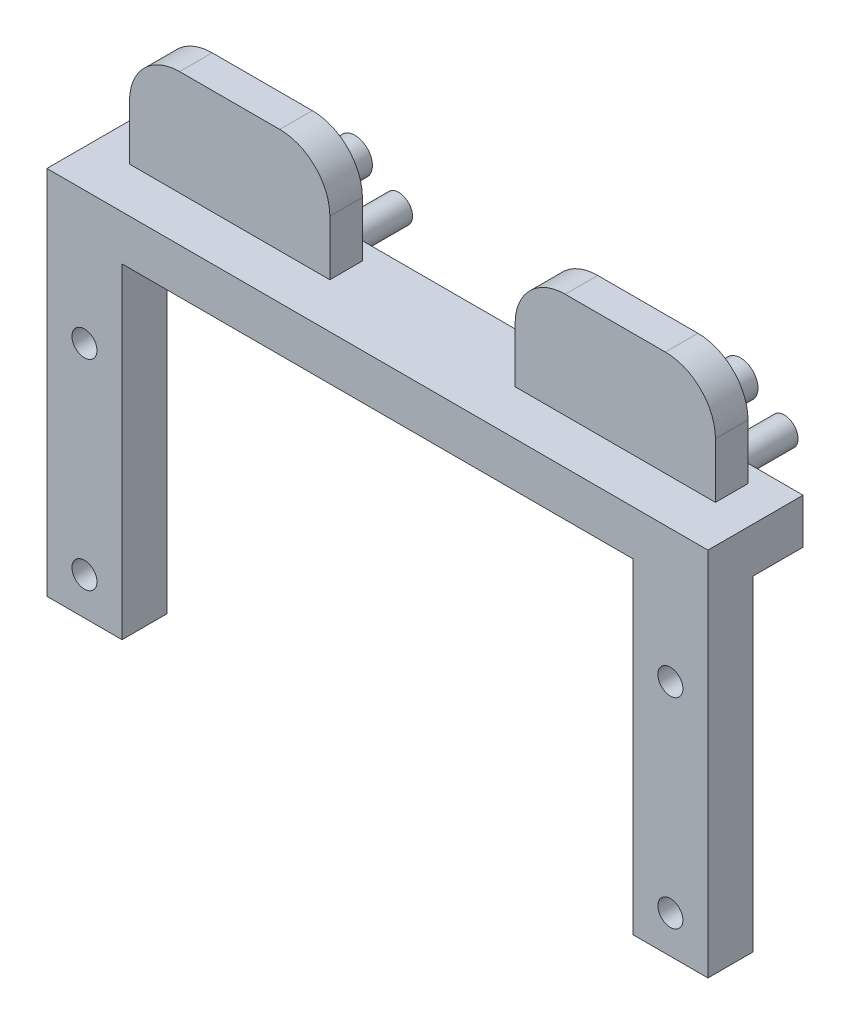
from build123d import *

# Parameters (mm, degrees)
BOSS_EXTRUDE2_START  = -1
SKETCH1_W            = 66
SKETCH1_H            = 19
BOSS_EXTRUDE2_DEPTH  = 9
SKETCH3_R            = 2.75
BOSS_EXTRUDE3_DEPTH  = 13.75
SKETCH4_W            = 4.5
SKETCH4_H            = 6.5
BOSS_EXTRUDE4_DEPTH  = 15
BOSS_EXTRUDE5_DEPTH  = 8.5
SKETCH8_W            = 9
SKETCH8_H            = 6.5
BOSS_EXTRUDE6_DEPTH  = 6
SKETCH9_W            = 15.5
SKETCH9_H            = 6.5
BOSS_EXTRUDE7_DEPTH  = 21
BOSS_EXTRUDE8_DEPTH  = 8.5
CUT_EXTRUDE2_START   = -8.5
SKETCH12_R           = 3.5
CUT_EXTRUDE2_DEPTH   = 8.5
FILLET1_R            = 10
SKETCH14_W           = 15
SKETCH14_H           = 9
BOSS_EXTRUDE10_DEPTH = 65
CUT_EXTRUDE3_REACH   = 98.312
SKETCH15_R           = 2.5
FILLET1_OF_MIRROR3_R = 10


with BuildPart() as part:
    # Sketch1 → Boss-Extrude2 (new body)
    with BuildSketch(Plane(origin=(0, 0, 0), x_dir=(1, 0, 0), z_dir=(0, 1, 0)).offset(BOSS_EXTRUDE2_START)):
        with Locations((33, 18)):
            Rectangle(SKETCH1_W, SKETCH1_H)
    boss_extrude2 = extrude(amount=BOSS_EXTRUDE2_DEPTH)

    # Sketch3 → Boss-Extrude3 (add)
    with BuildSketch(Plane(origin=(0, 0, -27.5), x_dir=(-1, 0, 0), z_dir=(0, 0, -1))):
        with Locations((-37.5, 3.5)):
            Circle(SKETCH3_R)
        with Locations((-17.5, 3.5)):
            Circle(SKETCH3_R)
    boss_extrude3 = extrude(amount=BOSS_EXTRUDE3_DEPTH)

    # Sketch4 → Boss-Extrude4 (add)
    with BuildSketch(Plane(origin=(0, 8, 0), x_dir=(1, 0, 0), z_dir=(0, 1, 0))):
        with Locations((25.25, 20.75)):
            Rectangle(SKETCH4_W, SKETCH4_H)
        with Locations((29.75, 20.75)):
            Rectangle(SKETCH4_W, SKETCH4_H)
    boss_extrude4 = extrude(amount=BOSS_EXTRUDE4_DEPTH)

    # Sketch5 → Boss-Extrude5 (add)
    with BuildSketch(Plane(origin=(0, 0, -24), x_dir=(-1, 0, 0), z_dir=(0, 0, -1))):
        with BuildLine():
            ThreePointArc((-25.636419782, 13.037388184), (-24.436298745, 14.307742745), (-24, 16))
            ThreePointArc((-24, 16), (-29.974873734, 18.474873734), (-27.5, 12.5))
            ThreePointArc((-27.5, 12.5), (-26.685966178, 12.595980474), (-25.916578842, 12.878657751))
            ThreePointArc((-25.916578842, 12.878657751), (-25.85405917, 13.094916041), (-25.636419782, 13.037388184))
        make_face()
    extrude(amount=BOSS_EXTRUDE5_DEPTH)

    # Sketch8 → Boss-Extrude6 (add)
    with BuildSketch(Plane(origin=(0, 23, 0), x_dir=(1, 0, 0), z_dir=(0, 1, 0))):
        with Locations((27.5, 20.75)):
            Rectangle(SKETCH8_W, SKETCH8_H)
    boss_extrude6 = extrude(amount=BOSS_EXTRUDE6_DEPTH)

    # Sketch9 → Boss-Extrude7 (add)
    with BuildSketch(Plane(origin=(0, 8, 0), x_dir=(1, 0, 0), z_dir=(0, 1, 0))):
        with Locations((39.75, 20.75)):
            Rectangle(SKETCH9_W, SKETCH9_H)
        with Locations((15.25, 20.75)):
            Rectangle(SKETCH9_W, SKETCH9_H)
    boss_extrude7 = extrude(amount=BOSS_EXTRUDE7_DEPTH)

    # Sketch10 → Boss-Extrude8 (add)
    with BuildSketch(Plane(origin=(0, 0, -24), x_dir=(-1, 0, 0), z_dir=(0, 0, -1))):
        with BuildLine():
            Line((-21, 17), (-17.5, 17))
            Line((-17.5, 17), (-14, 17))
            ThreePointArc((-14, 17), (-17.5, 20.5), (-21, 17))
        make_face()
        with BuildLine():
            Line((-17.5, 13.5), (-17.5, 17))
            Line((-17.5, 17), (-21, 17))
            ThreePointArc((-21, 17), (-19.974873734, 14.525126266), (-17.5, 13.5))
        make_face()
        with BuildLine():
            Line((-14, 17), (-17.5, 17))
            Line((-17.5, 17), (-17.5, 13.5))
            ThreePointArc((-17.5, 13.5), (-15.025126266, 14.525126266), (-14, 17))
        make_face()
        with BuildLine():
            Line((-37.5, 17), (-34, 17))
            ThreePointArc((-34, 17), (-37.5, 20.5), (-41, 17))
            Line((-41, 17), (-37.5, 17))
        make_face()
        with BuildLine():
            ThreePointArc((-37.5, 13.5), (-35.025126266, 14.525126266), (-34, 17))
            Line((-34, 17), (-37.5, 17))
            Line((-37.5, 17), (-37.5, 13.5))
        make_face()
        with BuildLine():
            Line((-37.5, 13.5), (-37.5, 17))
            Line((-37.5, 17), (-41, 17))
            ThreePointArc((-41, 17), (-39.974873734, 14.525126266), (-37.5, 13.5))
        make_face()
    boss_extrude8 = extrude(amount=BOSS_EXTRUDE8_DEPTH)

    # Sketch12 → Cut-Extrude2 (cut)
    with BuildSketch(Plane(origin=(0, 0, -32.5), x_dir=(-1, 0, 0), z_dir=(0, 0, -1)).offset(CUT_EXTRUDE2_START)):
        with Locations((-27.5, 16)):
            Circle(SKETCH12_R)
    extrude(amount=CUT_EXTRUDE2_DEPTH, mode=Mode.SUBTRACT)

    # Fillet1
    fillet1_edges = [part.edges().sort_by_distance(p)[0] for p in [
        (7.5, 29, -20.75),
        (47.5, 29, -20.75),
    ]]
    fillet(fillet1_edges, radius=FILLET1_R)

    # Sketch14 → Boss-Extrude10 (add)
    with BuildSketch(Plane.XZ.offset(1)):
        with Locations((7.5, -13)):
            Rectangle(SKETCH14_W, SKETCH14_H)
    boss_extrude10 = extrude(amount=BOSS_EXTRUDE10_DEPTH)

    # Sketch15 → Cut-Extrude3 (cut, up to next)
    with BuildSketch(Plane(origin=(0, 0, -17.5), x_dir=(-1, 0, 0), z_dir=(0, 0, -1)), mode=Mode.PRIVATE) as cut_extrude3_sk1:
        with Locations((-7.5, -18.5)):
            Circle(SKETCH15_R)
    cut_extrude3_tool1 = extrude(cut_extrude3_sk1.sketch, amount=-CUT_EXTRUDE3_REACH, mode=Mode.PRIVATE) & part.part
    # Sketch15 → Cut-Extrude3 (cut, up to next)
    with BuildSketch(Plane(origin=(0, 0, -17.5), x_dir=(-1, 0, 0), z_dir=(0, 0, -1)), mode=Mode.PRIVATE) as cut_extrude3_sk2:
        with Locations((-7.5, -58.5)):
            Circle(SKETCH15_R)
    cut_extrude3_tool2 = extrude(cut_extrude3_sk2.sketch, amount=-CUT_EXTRUDE3_REACH, mode=Mode.PRIVATE) & part.part
    cut_extrude3_1 = cut_extrude3_tool1.solids().sort_by_distance((7.5, -18.5, -17.5))[0]
    add(cut_extrude3_1, mode=Mode.SUBTRACT)
    cut_extrude3_2 = cut_extrude3_tool2.solids().sort_by_distance((7.5, -58.5, -17.5))[0]
    add(cut_extrude3_2, mode=Mode.SUBTRACT)
    cut_extrude3 = cut_extrude3_1 + cut_extrude3_2  # Cut-Extrude3 as one shape, for the pattern or mirror that repeats it

    # Mirror3: Boss-Extrude2, Boss-Extrude3, Boss-Extrude4, Boss-Extrude6, Boss-Extrude7, Boss-Extrude8, Boss-Extrude10, Cut-Extrude3 across plane
    add(boss_extrude2.mirror(Plane(origin=(66, -1, -8.5), x_dir=(0, 0, 1), z_dir=(1, 0, 0))))
    add(boss_extrude3.mirror(Plane(origin=(66, -1, -8.5), x_dir=(0, 0, 1), z_dir=(1, 0, 0))))
    add(boss_extrude4.mirror(Plane(origin=(66, -1, -8.5), x_dir=(0, 0, 1), z_dir=(1, 0, 0))))
    add(boss_extrude6.mirror(Plane(origin=(66, -1, -8.5), x_dir=(0, 0, 1), z_dir=(1, 0, 0))))
    add(boss_extrude7.mirror(Plane(origin=(66, -1, -8.5), x_dir=(0, 0, 1), z_dir=(1, 0, 0))))
    add(boss_extrude8.mirror(Plane(origin=(66, -1, -8.5), x_dir=(0, 0, 1), z_dir=(1, 0, 0))))
    add(boss_extrude10.mirror(Plane(origin=(66, -1, -8.5), x_dir=(0, 0, 1), z_dir=(1, 0, 0))))
    add(cut_extrude3.mirror(Plane(origin=(66, -1, -8.5), x_dir=(0, 0, 1), z_dir=(1, 0, 0))), mode=Mode.SUBTRACT)

    # Fillet1 of Mirror3
    fillet1_of_mirror3_edges = [part.edges().sort_by_distance(p)[0] for p in [
        (124.5, 29, -20.75),
        (84.5, 29, -20.75),
    ]]
    fillet(fillet1_of_mirror3_edges, radius=FILLET1_OF_MIRROR3_R)


solid = part.part
